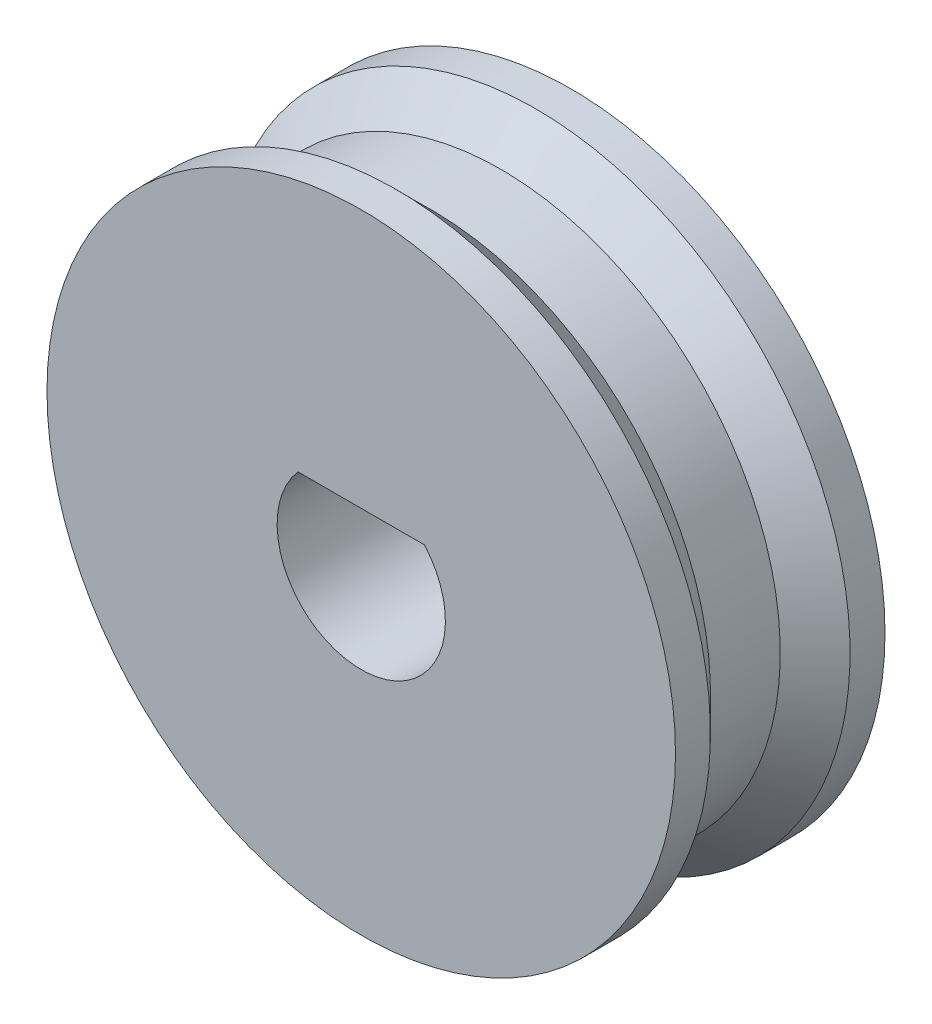
from build123d import *

# Parameters (mm, degrees)
SKETCH1_R                 = 4.5
MAIN_BASE_DEPTH           = 3
MOTOR_SHAFT_CUT_OUT_DEPTH = 8.03562364


with BuildPart() as part:
    # Sketch1 → main_base (new body)
    with BuildSketch(Plane.XY):
        Circle(SKETCH1_R)
    extrude(amount=MAIN_BASE_DEPTH)

    # Sketch2 → pulley_cut_out (revolve, cut)
    with BuildSketch(Plane(origin=(0, 0, 0), x_dir=(0, 0, -1), z_dir=(1, 0, 0)), mode=Mode.PRIVATE) as pulley_cut_out_sk:
        Polygon((-2.5, 4.5), (-0.5, 4.5), (-1, 4), (-2, 4), align=None)
    revolve(pulley_cut_out_sk.sketch.rotate(Axis((0, 0, 0), (0, 0, 1)), 90), axis=Axis((0, 0, 0), (0, 0, 1)), mode=Mode.SUBTRACT)

    # Sketch3 → motor_shaft_cut_out (cut, through all)
    with BuildSketch(Plane.XY):
        with BuildLine():
            ThreePointArc((1.205, 0), (1.127652187, 0.424765283), (0.905538514, 0.795))
            Line((0.905538514, 0.795), (-0.905538514, 0.795))
            ThreePointArc((-0.905538514, 0.795), (-0.424765283, -1.127652187), (1.205, 0))
        make_face()
    extrude(amount=MOTOR_SHAFT_CUT_OUT_DEPTH, mode=Mode.SUBTRACT)


solid = part.part
